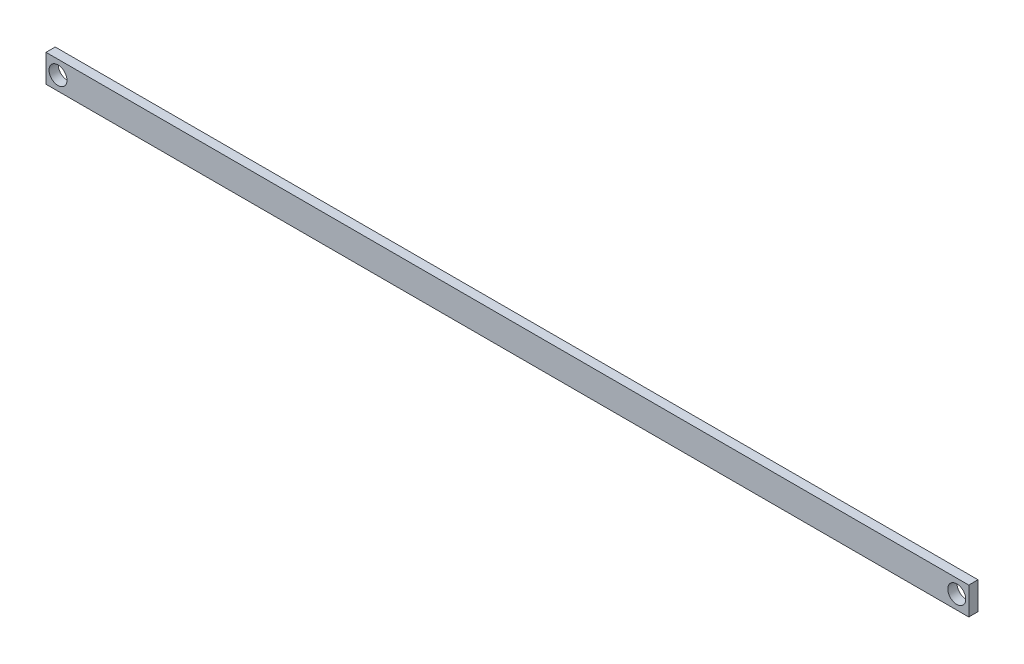
from build123d import *

# Parameters (mm, degrees)
SKETCH2_W           = 500
SKETCH2_H           = 15
BOSS_EXTRUDE1_DEPTH = 5
SKETCH3_R           = 4.85
CUT_EXTRUDE1_DEPTH  = 5


with BuildPart() as part:
    # Sketch2 → Boss-Extrude1 (new body)
    with BuildSketch(Plane.XY):
        with Locations((250, -7.5)):
            Rectangle(SKETCH2_W, SKETCH2_H)
    extrude(amount=-BOSS_EXTRUDE1_DEPTH)

    # Sketch3 → Cut-Extrude1 (cut)
    with BuildSketch(Plane.XY):
        with Locations((6.5, -7.5)):
            Circle(SKETCH3_R)
        with Locations((493.5, -7.5)):
            Circle(SKETCH3_R)
    extrude(amount=-CUT_EXTRUDE1_DEPTH, mode=Mode.SUBTRACT)


solid = part.part
